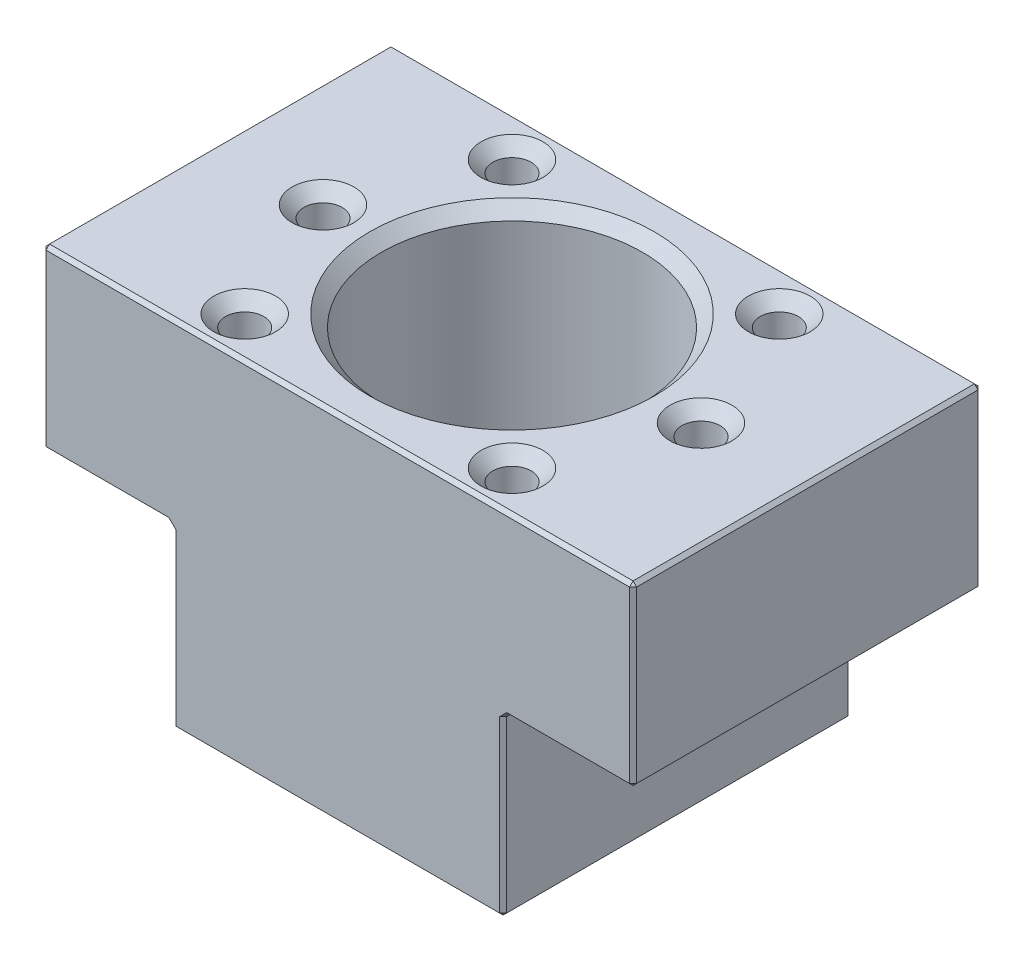
from build123d import *

# Parameters (mm, degrees)
BOSS_EXTRUDE1_DEPTH = 14.75
SKETCH2_R           = 11.05
CUT_EXTRUDE1_DEPTH  = 42.744011547
SKETCH4_R           = 2.115
CUT_EXTRUDE2_DEPTH  = 12
SKETCH5_R           = 1.62
CUT_EXTRUDE3_DEPTH  = 12
CHAMFER1_SIZE       = 1
CHAMFER2_SIZE       = 0.5
CHAMFER3_SIZE       = 0.3


with BuildPart() as part:
    # Sketch1 → Boss-Extrude1 (new, symmetric)
    with BuildSketch(Plane.XY):
        Polygon((14, -15), (-14, -15), (-14, 0), (-25, 0), (-25, 15), (25, 15), (25, 0), (14, 0), align=None)
    extrude(amount=BOSS_EXTRUDE1_DEPTH, both=True)

    # Sketch2 → Cut-Extrude1 (cut, through all)
    with BuildSketch(Plane(origin=(0, 15, 0), x_dir=(1, 0, 0), z_dir=(0, 1, 0))):
        with Locations(Location((0, 0, 0), (0, 0, 180))):
            Circle(SKETCH2_R)
    extrude(amount=-CUT_EXTRUDE1_DEPTH, mode=Mode.SUBTRACT)

    # Sketch4 → Cut-Extrude2 (cut)
    with BuildSketch(Plane(origin=(0, 0, -14.75), x_dir=(-1, 0, 0), z_dir=(0, 0, -1))):
        with Locations((-17.5, 9)):
            Circle(SKETCH4_R)
        with Locations((17.5, 9)):
            Circle(SKETCH4_R)
        with Locations((0, -9)):
            Circle(SKETCH4_R)
    extrude(amount=-CUT_EXTRUDE2_DEPTH, mode=Mode.SUBTRACT)

    # Sketch5 → Cut-Extrude3 (cut)
    with BuildSketch(Plane(origin=(0, 15, 0), x_dir=(1, 0, 0), z_dir=(0, 1, 0))):
        with Locations(Location((16, 0, 0), (0, 0, 180))):
            Circle(SKETCH5_R)
        with Locations(Location((11.313708499, -11.313708499, 0), (0, 0, 180))):
            Circle(SKETCH5_R)
        with Locations(Location((-11.313708499, -11.313708499, 0), (0, 0, 180))):
            Circle(SKETCH5_R)
        with Locations(Location((-16, 0, 0), (0, 0, 180))):
            Circle(SKETCH5_R)
        with Locations(Location((-11.313708499, 11.313708499, 0), (0, 0, 180))):
            Circle(SKETCH5_R)
        with Locations(Location((11.313708499, 11.313708499, 0), (0, 0, 180))):
            Circle(SKETCH5_R)
    extrude(amount=-CUT_EXTRUDE3_DEPTH, mode=Mode.SUBTRACT)

    # Chamfer1
    chamfer1_edges = [part.edges().sort_by_distance(p)[0] for p in [
        (11.05, 15, 0),
        (17.62, 15, 0),
        (12.933708499, 15, 11.313708499),
        (-9.693708499, 15, 11.313708499),
        (-14.38, 15, 0),
        (-9.693708499, 15, -11.313708499),
        (12.933708499, 15, -11.313708499),
    ]]
    chamfer(chamfer1_edges, length=CHAMFER1_SIZE)

    # Chamfer2
    chamfer2_edges = [part.edges().sort_by_distance(p)[0] for p in [
        (19.615, 9, -14.75),
        (-15.385, 9, -14.75),
        (2.115, -9, -14.75),
    ]]
    chamfer(chamfer2_edges, length=CHAMFER2_SIZE)

    # Chamfer3
    chamfer3_edges = [part.edges().sort_by_distance(p)[0] for p in [
        (0, 15, 14.75),
        (25, 7.5, -14.75),
        (19.5, 0, -14.75),
        (-25, 7.5, 14.75),
        (14, 0, 0),
        (14, -15, 0),
        (-14, -15, 0),
        (-14, 0, 0),
        (-25, 0, 0),
        (-25, 15, 0),
        (25, 15, 0),
        (25, 0, 0),
        (-19.5, 0, 14.75),
        (-14, -7.5, 14.75),
        (0, -15, 14.75),
        (11.05, -15, 0),
        (14, -7.5, 14.75),
        (19.5, 0, 14.75),
        (25, 7.5, 14.75),
        (14, -7.5, -14.75),
        (0, -15, -14.75),
        (-14, -7.5, -14.75),
        (-19.5, 0, -14.75),
        (-25, 7.5, -14.75),
        (0, 15, -14.75),
    ]]
    chamfer(chamfer3_edges, length=CHAMFER3_SIZE)


solid = part.part
